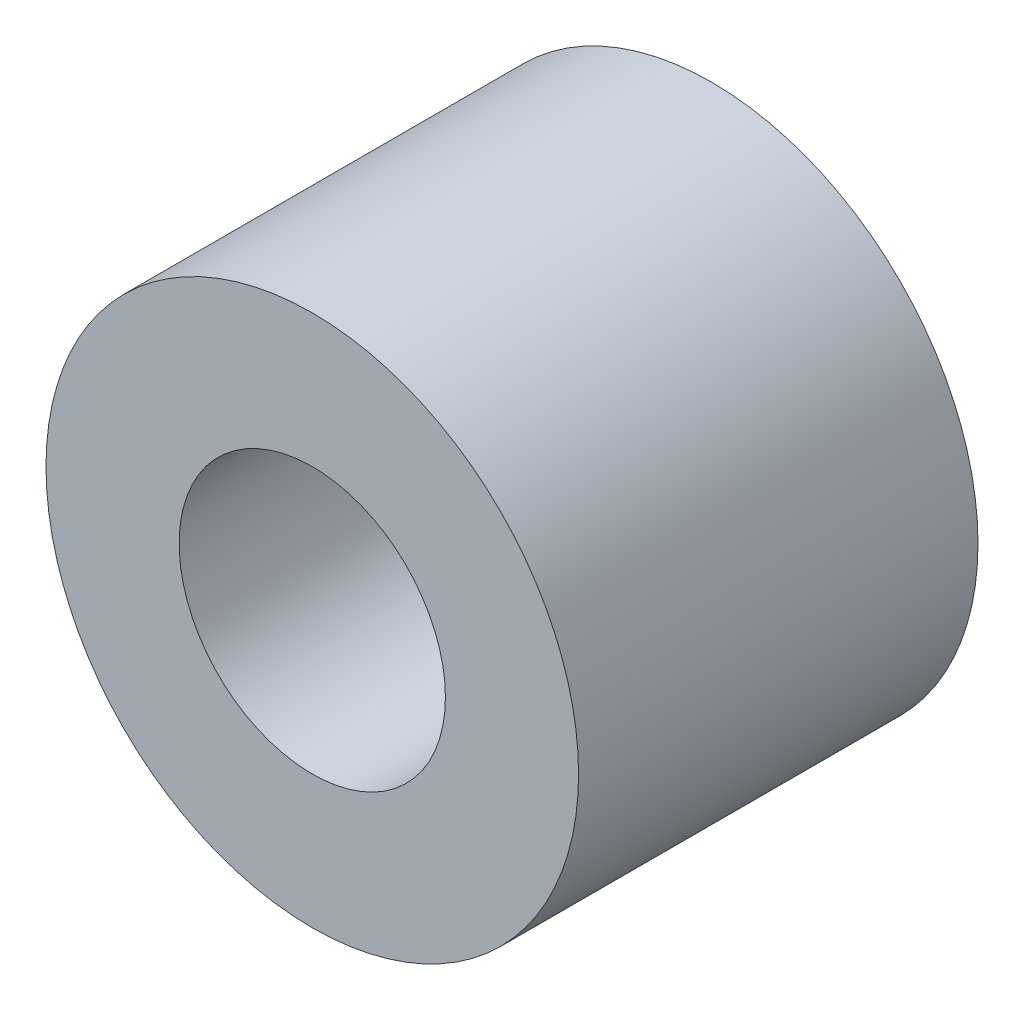
from build123d import *

# Parameters (mm, degrees)
SKETCH1_R     = 6
SKETCH1_R_2   = 3
PROFILE_DEPTH = 9


with BuildPart() as part:
    # Sketch1 → Profile (new body)
    with BuildSketch(Plane.XY):
        with Locations((6, 6)):
            Circle(SKETCH1_R)
        with Locations((6, 6)):
            Circle(SKETCH1_R_2, mode=Mode.SUBTRACT)
    extrude(amount=PROFILE_DEPTH)


solid = part.part
